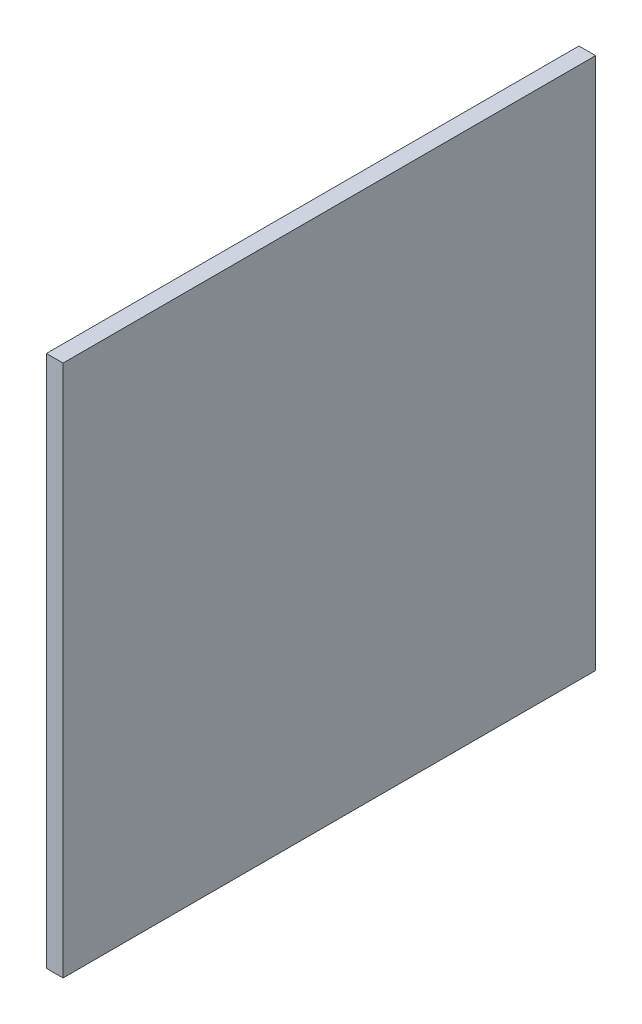
from build123d import *

# Parameters (mm, degrees)
SKETCH1_W           = 203.2
SKETCH1_H           = 203.2
BOSS_EXTRUDE1_DEPTH = 6.35


with BuildPart() as part:
    # Sketch1 → Boss-Extrude1 (new body)
    with BuildSketch(Plane(origin=(0, 0, 0), x_dir=(0, 0, -1), z_dir=(1, 0, 0))):
        Rectangle(SKETCH1_W, SKETCH1_H)
    extrude(amount=BOSS_EXTRUDE1_DEPTH)


solid = part.part
